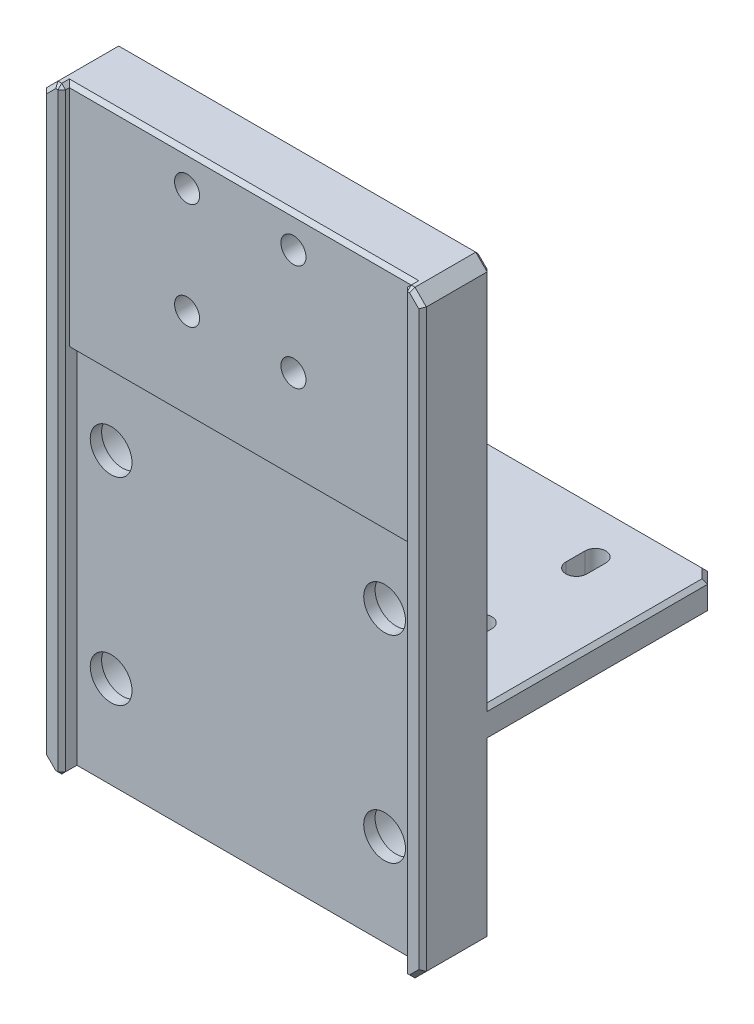
from build123d import *

# Parameters (mm, degrees)
SKETCH_1_W                = 100
SKETCH_1_H                = 157.5
EXTRUDE_1_DEPTH           = 18
SKETCH_2_W                = 90
SKETCH_2_H                = 220
CUT_EXTRUDE_1_DEPTH       = 2
SKETCH_3_W                = 90
SKETCH_3_H                = 195
CUT_EXTRUDE_2_DEPTH       = 2
SKETCH_4_W                = 60
SKETCH_4_H                = 8
EXTRUDE_2_DEPTH           = 100
EXTRUDE_3_DEPTH           = 6
HOLE_WIZARD_0_D           = 11
HOLE_WIZARD_0_CBORE_D     = 18
HOLE_WIZARD_0_CBORE_DEPTH = 11
HOLE_WIZARD_1_D           = 6.6
HOLE_WIZARD_1_CBORE_D     = 11
HOLE_WIZARD_1_CBORE_DEPTH = 6.8
FILLET_1_R                = 10
CUT_EXTRUDE_3_DEPTH       = 136.111296715
CHAMFER_1_SIZE            = 3
CHAMFER_2_SIZE            = 1


with BuildPart() as part:
    # 草图1 → 凸台-拉伸1 (new body)
    with BuildSketch(Plane.XY):
        Rectangle(SKETCH_1_W, SKETCH_1_H)
    extrude(amount=EXTRUDE_1_DEPTH)

    # 草图2 → 切除-拉伸1 (cut)
    with BuildSketch(Plane.XY.offset(18)):
        Rectangle(SKETCH_2_W, SKETCH_2_H)
    extrude(amount=-CUT_EXTRUDE_1_DEPTH, mode=Mode.SUBTRACT)

    # 草图3 → 切除-拉伸2 (cut)
    with BuildSketch(Plane.XY.offset(16)):
        with Locations((0, -78.75)):
            Rectangle(SKETCH_3_W, SKETCH_3_H)
    extrude(amount=-CUT_EXTRUDE_2_DEPTH, mode=Mode.SUBTRACT)

    # 草图4 → 凸台-拉伸2 (add)
    with BuildSketch(Plane.ZY.offset(50)):
        with Locations((-30, -27.5)):
            Rectangle(SKETCH_4_W, SKETCH_4_H)
    extrude(amount=-EXTRUDE_2_DEPTH)

    # 草图5 → 凸台-拉伸3 (add, symmetric)
    with BuildSketch(Plane(origin=(0, 0, 0), x_dir=(0, 0, -1), z_dir=(1, 0, 0))):
        Polygon((0, -31.5), (0, -78.75), (8, -78.75), (60, -39.5), (60, -31.5), align=None)
    extrude(amount=EXTRUDE_3_DEPTH, both=True)

    # 打孔尺寸(%根据)内六角圆柱头螺钉的类型0 (through all)
    with Locations(Plane(origin=(0, 0, 0), x_dir=(-1, 0, 0), z_dir=(0, 0, -1))):
        with Locations((-36, -1.5), (36, -1.5), (36, -53.5), (-36, -53.5)):
            CounterBoreHole(HOLE_WIZARD_0_D / 2, HOLE_WIZARD_0_CBORE_D / 2, HOLE_WIZARD_0_CBORE_DEPTH)

    # 打孔尺寸(%根据)内六角圆柱头螺钉的类型1 (through all)
    with Locations(Plane(origin=(0, 0, 0), x_dir=(-1, 0, 0), z_dir=(0, 0, -1))):
        with Locations((-14, 70.25), (-14, 42.25), (14, 70.25), (14, 42.25)):
            CounterBoreHole(HOLE_WIZARD_1_D / 2, HOLE_WIZARD_1_CBORE_D / 2, HOLE_WIZARD_1_CBORE_DEPTH)

    # 圆角1
    fillet_1_edges = [part.edges().sort_by_distance(p)[0] for p in [
        (0, -78.75, -8),
        (0, -39.5, -60),
    ]]
    fillet(fillet_1_edges, radius=FILLET_1_R)

    # 草图12 → 切除-拉伸3 (cut, through all)
    with BuildSketch(Plane.XZ.offset(31.5)):
        with BuildLine():
            Line((32.75, -42.5), (32.75, -47.5))
            ThreePointArc((32.75, -47.5), (30, -50.25), (27.25, -47.5))
            Line((27.25, -47.5), (27.25, -42.5))
            ThreePointArc((27.25, -42.5), (30, -39.75), (32.75, -42.5))
        make_face()
        with BuildLine():
            Line((32.75, -12.5), (32.75, -17.5))
            ThreePointArc((32.75, -17.5), (30, -20.25), (27.25, -17.5))
            Line((27.25, -17.5), (27.25, -12.5))
            ThreePointArc((27.25, -12.5), (30, -9.75), (32.75, -12.5))
        make_face()
        with BuildLine():
            Line((-32.75, -47.5), (-32.75, -42.5))
            ThreePointArc((-32.75, -42.5), (-30, -39.75), (-27.25, -42.5))
            Line((-27.25, -42.5), (-27.25, -47.5))
            ThreePointArc((-27.25, -47.5), (-30, -50.25), (-32.75, -47.5))
        make_face()
        with BuildLine():
            Line((-27.25, -12.5), (-27.25, -17.5))
            ThreePointArc((-27.25, -17.5), (-30, -20.25), (-32.75, -17.5))
            Line((-32.75, -17.5), (-32.75, -12.5))
            ThreePointArc((-32.75, -12.5), (-30, -9.75), (-27.25, -12.5))
        make_face()
    extrude(amount=-CUT_EXTRUDE_3_DEPTH, mode=Mode.SUBTRACT)

    # 倒角1
    chamfer_1_edges = [part.edges().sort_by_distance(p)[0] for p in [
        (-50, -27.5, -60),
        (50, -27.5, -60),
        (50, -78.75, 9),
        (-50, -78.75, 9),
        (-50, 78.75, 9),
        (50, 78.75, 9),
    ]]
    chamfer(chamfer_1_edges, length=CHAMFER_1_SIZE)

    # 倒角2
    chamfer_2_edges = [part.edges().sort_by_distance(p)[0] for p in [
        (-46, 78.75, 18),
        (46, -78.75, 18),
        (-45, 0, 18),
        (45, 0, 18),
        (-6, -59.616129225, -33.349331982),
        (6, -59.616129225, -33.349331982),
        (-6, -33.009585867, -60),
        (-6, -38.977573733, -58.951125718),
        (-6, -78.231967981, -7.826438724),
        (6, -33.009585867, -60),
        (6, -38.977573733, -58.951125718),
        (6, -78.231967981, -7.826438724),
        (0, 78.75, 16),
        (45, 78.75, 17),
        (45, -78.75, 16),
        (-45, 78.75, 17),
        (-45, -78.75, 16),
        (50, -53.625, 0),
        (50, -23.5, -28.5),
        (50, 0, 18),
        (0, -23.5, -60),
        (-48.5, -23.5, -58.5),
        (48.5, -23.5, -58.5),
        (26.5, -31.5, -60),
        (48.5, -31.5, -58.5),
        (-50, 26.125, 0),
        (-50, -31.5, -28.5),
        (-50, 0, 18),
        (-48.5, -31.5, -58.5),
        (-46, -78.75, 18),
        (-26.5, -78.75, 0),
        (-48.5, -77.25, 0),
        (-48.5, 77.25, 18),
        (-48.5, -77.25, 18),
        (48.5, -77.25, 0),
        (46, 78.75, 18),
        (48.5, 77.25, 18),
        (48.5, -77.25, 18),
        (0, 78.75, 0),
        (-48.5, 77.25, 0),
        (48.5, 77.25, 0),
        (0, -78.75, 14),
        (50, 26.125, 0),
        (-50, -53.625, 0),
        (-50, -23.5, -28.5),
        (50, -31.5, -28.5),
        (-26.5, -31.5, -60),
        (26.5, -78.75, 0),
        (-6, -78.75, -2.324801658),
        (6, -78.75, -2.324801658),
    ]]
    chamfer(chamfer_2_edges, length=CHAMFER_2_SIZE)


solid = part.part
